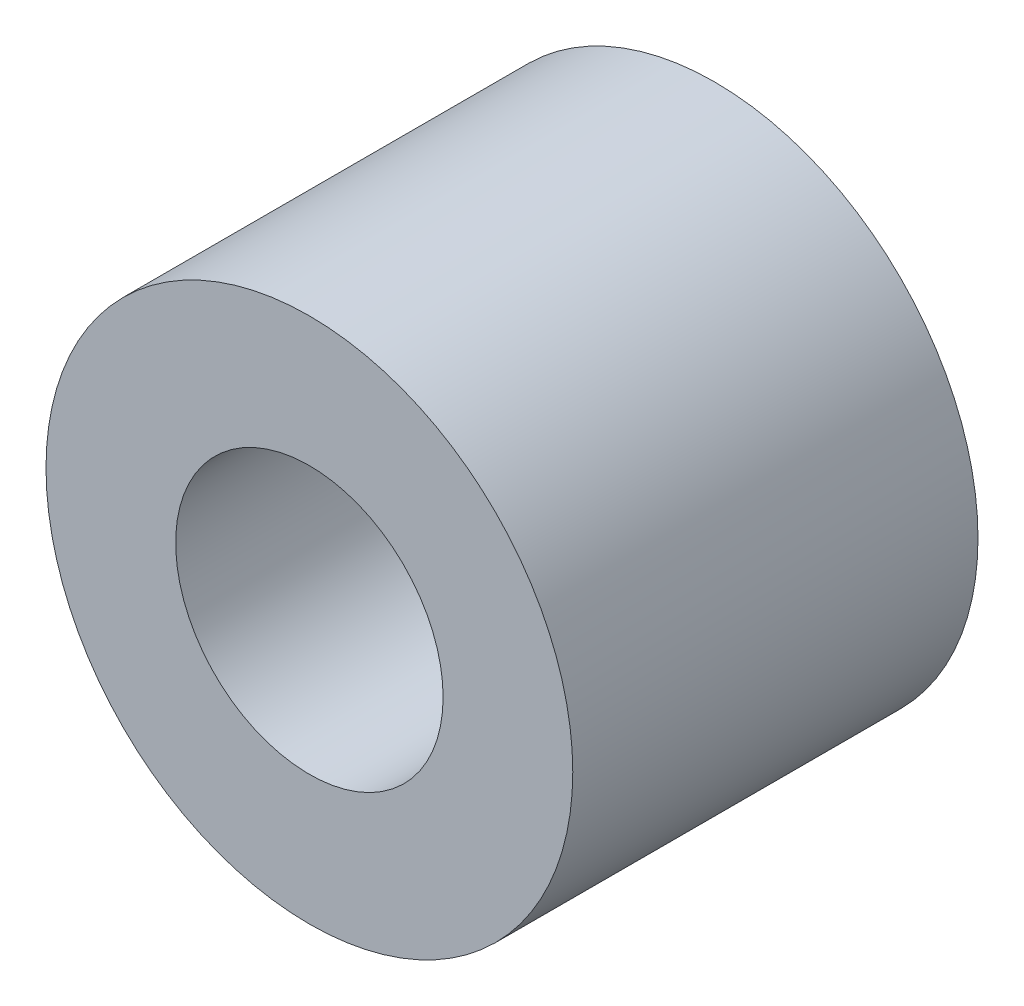
from build123d import *

# Parameters (mm, degrees)
SKETCH1_R           = 3.25
SKETCH1_R_2         = 1.65
BOSS_EXTRUDE1_DEPTH = 5


with BuildPart() as part:
    # Sketch1 → Boss-Extrude1 (new body)
    with BuildSketch(Plane.XY):
        Circle(SKETCH1_R)
        Circle(SKETCH1_R_2, mode=Mode.SUBTRACT)
    extrude(amount=BOSS_EXTRUDE1_DEPTH)


solid = part.part
